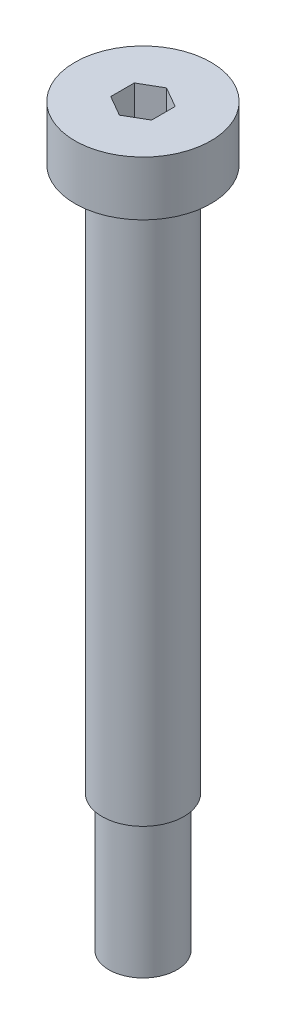
from build123d import *

# Parameters (mm, degrees)
CUT_EXTRUDE2_DEPTH = 3


with BuildPart() as part:
    # Sketch3 → Revolve2 (revolve)
    with BuildSketch(Plane.XY):
        Polygon((0, 0), (-5, 0), (-5, -4), (-3, -4), (-3, -44), (-2.5, -44), (-2.5, -54), (0, -54), align=None)
    revolve(axis=Axis((0, 0, 0), (0, -1, 0)))

    # Sketch4 → Cut-Extrude2 (cut)
    with BuildSketch(Plane(origin=(0, 0, 0), x_dir=(1, 0, 0), z_dir=(0, 1, 0))):
        Polygon((1.5, 0.866025404), (0, 1.732050808), (-1.5, 0.866025404), (-1.5, -0.866025404), (0, -1.732050808), (1.5, -0.866025404), align=None)
    extrude(amount=-CUT_EXTRUDE2_DEPTH, mode=Mode.SUBTRACT)


solid = part.part
